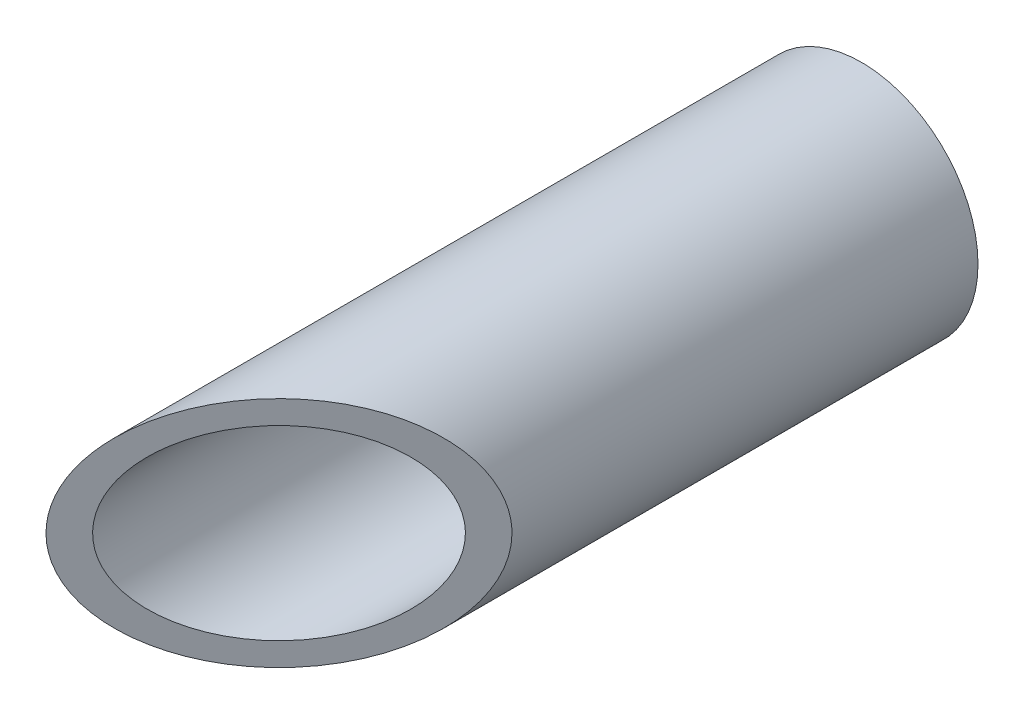
from build123d import *

# Parameters (mm, degrees)
SKETCH1_R           = 25
SKETCH1_R_2         = 20
BOSS_EXTRUDE1_DEPTH = 150
CUT_EXTRUDE1_DEPTH  = 500


with BuildPart() as part:
    # Sketch1 → Boss-Extrude1 (new body)
    with BuildSketch(Plane.XY):
        Circle(SKETCH1_R)
        Circle(SKETCH1_R_2, mode=Mode.SUBTRACT)
    extrude(amount=BOSS_EXTRUDE1_DEPTH)

    # Sketch2 → Cut-Extrude1 (cut)
    with BuildSketch(Plane(origin=(0, -25, 0), x_dir=(-1, 0, 0), z_dir=(0, -1, 0))):
        Polygon((25, -150), (-25, -100), (-25, -150), align=None)
    extrude(amount=-CUT_EXTRUDE1_DEPTH, mode=Mode.SUBTRACT)


solid = part.part
